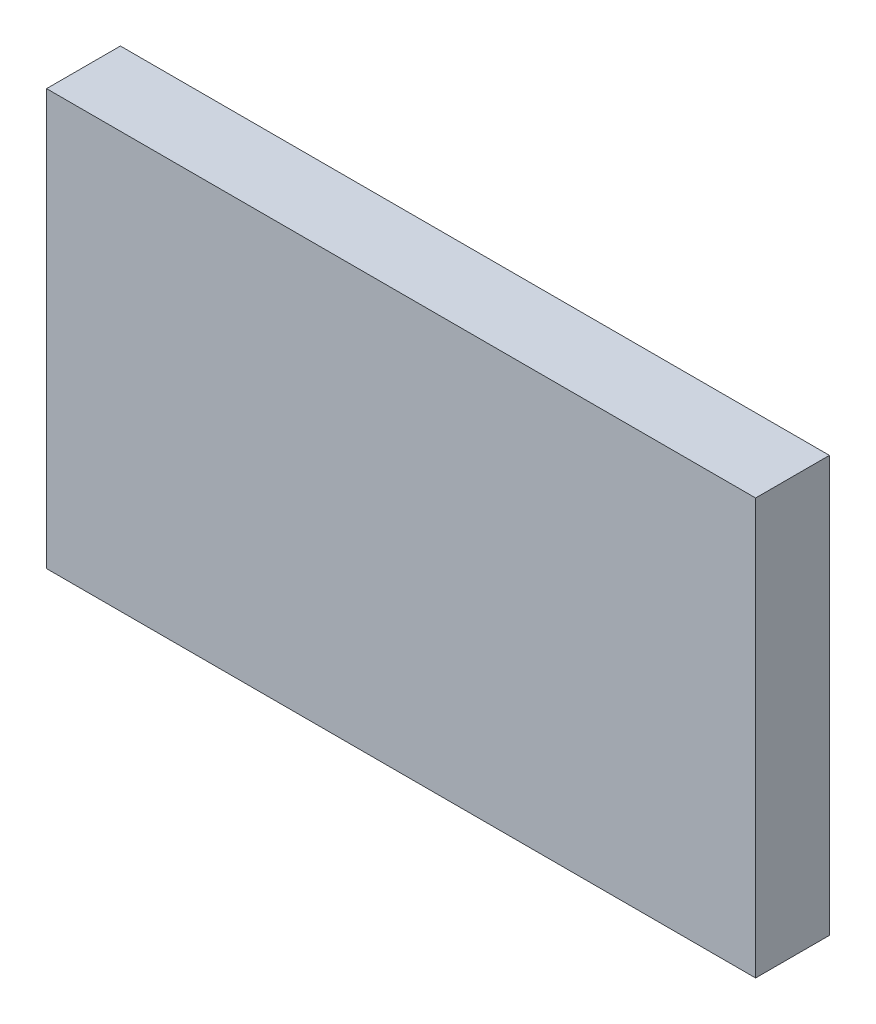
from build123d import *

# Parameters (mm, degrees)
ESBO_O1_W                = 730
ESBO_O1_H                = 428
RESSALTO_EXTRUS_O1_DEPTH = 76


with BuildPart() as part:
    # Esboço1 → Ressalto-extrusão1 (new body)
    with BuildSketch(Plane.XY):
        with Locations((-305.512804065, 1656.548133025)):
            Rectangle(ESBO_O1_W, ESBO_O1_H)
    extrude(amount=RESSALTO_EXTRUS_O1_DEPTH)


solid = part.part
